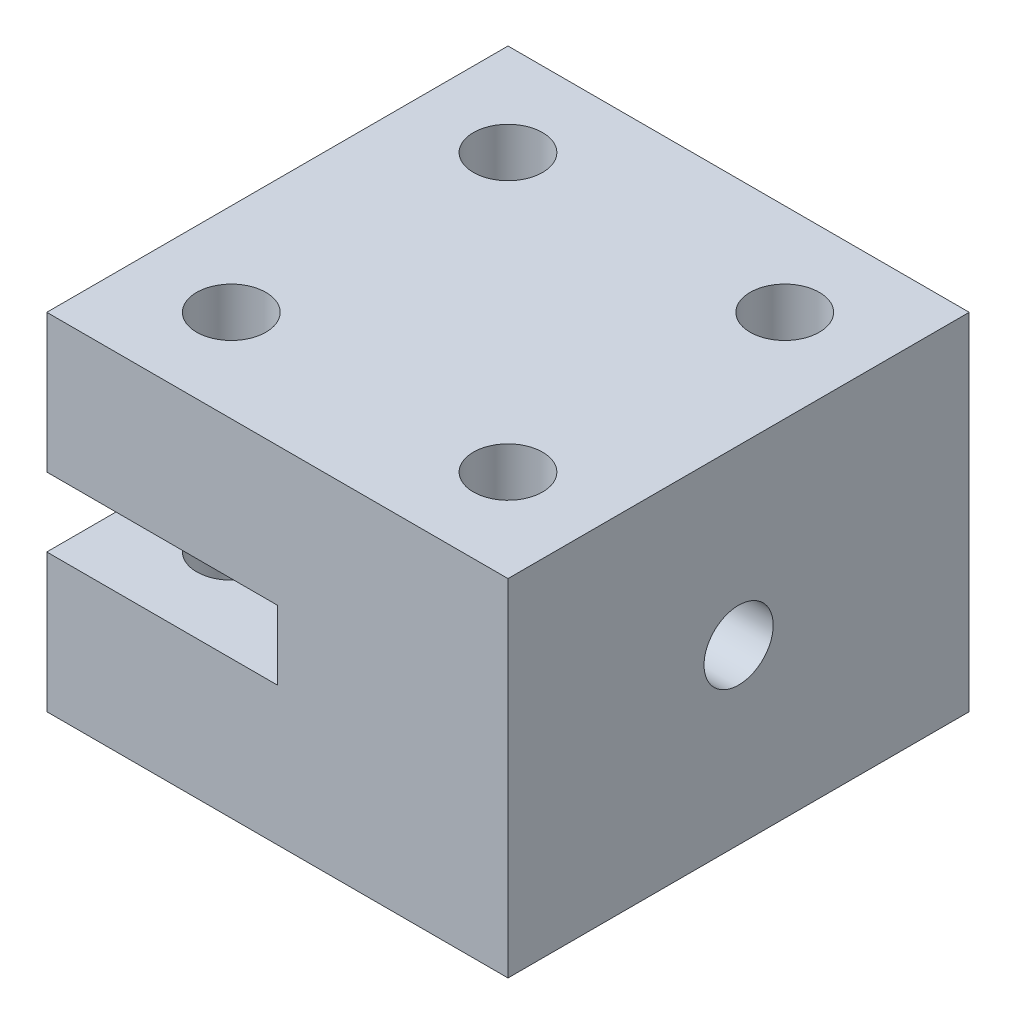
from build123d import *

# Parameters (mm, degrees)
SKETCH1_W               = 20
SKETCH1_H               = 20
BOSS_EXTRUDE1_DEPTH     = 7.5
SKETCH1_3_W             = 20
SKETCH1_3_H             = 20
CUT_EXTRUDE2_DEPTH      = 1.5
SKETCH3_W               = 10
SKETCH3_H               = 20
BOSS_EXTRUDE2_DEPTH     = 1.5
SKETCH4_R               = 1.5
CUT_EXTRUDE3_DEPTH      = 7.5
CUT_EXTRUDE4_DEPTH      = 17.007810594
CUT_EXTRUDE4_DEPTH_BACK = 17.007810594
SKETCH5_R               = 1.5


with BuildPart() as part:
    # Sketch1 → Boss-Extrude1 (new, symmetric)
    with BuildSketch(Plane(origin=(0, 0, 0), x_dir=(1, 0, 0), z_dir=(0, 1, 0))):
        Rectangle(SKETCH1_W, SKETCH1_H)
    extrude(amount=BOSS_EXTRUDE1_DEPTH, both=True)

    # Sketch1<3> → Cut-Extrude2 (cut, symmetric)
    with BuildSketch(Plane(origin=(0, 0, 0), x_dir=(1, 0, 0), z_dir=(0, 1, 0))):
        Rectangle(SKETCH1_3_W, SKETCH1_3_H)
    extrude(amount=CUT_EXTRUDE2_DEPTH, both=True, mode=Mode.SUBTRACT)


with BuildPart() as cut_extrude2_piece_1:
    # of the separate pieces the step leaves, piece 1, a body of its own (cut_extrude2_pieces)
    add(part.part.solids().sort_by_distance((-10, -7.5, -10))[0])



with BuildPart() as cut_extrude2_piece_2:
    # of the separate pieces the step leaves, piece 2, a body of its own (cut_extrude2_pieces)
    add(part.part.solids().sort_by_distance((-10, 1.5, -10))[0])


with BuildPart() as cut_extrude2_piece_1_1:
    add(cut_extrude2_piece_1.part)

    add(cut_extrude2_piece_2.part)  # Boss-Extrude2 merges Cut-Extrude2 piece 2
    # Sketch3 → Boss-Extrude2 (add, symmetric)
    with BuildSketch(Plane(origin=(0, 0, 0), x_dir=(1, 0, 0), z_dir=(0, 1, 0))):
        with Locations((5, 0)):
            Rectangle(SKETCH3_W, SKETCH3_H)
    extrude(amount=BOSS_EXTRUDE2_DEPTH, both=True)

    # Sketch4 → Cut-Extrude3 (cut)
    with BuildSketch(Plane(origin=(10, 0, 0), x_dir=(0, 0, -1), z_dir=(1, 0, 0))):
        Circle(SKETCH4_R)
    extrude(amount=-CUT_EXTRUDE3_DEPTH, mode=Mode.SUBTRACT)

    # Sketch5 → Cut-Extrude4 (cut, two sides: drawn at the far end of the back side and taken through both)
    with BuildSketch(Plane(origin=(0, 0, 0), x_dir=(1, 0, 0), z_dir=(0, 1, 0)).offset(-CUT_EXTRUDE4_DEPTH_BACK)):
        with Locations((-6, 6)):
            Circle(SKETCH5_R)
        with Locations((6, 6)):
            Circle(SKETCH5_R)
        with Locations((6, -6)):
            Circle(SKETCH5_R)
        with Locations((-6, -6)):
            Circle(SKETCH5_R)
    extrude(amount=CUT_EXTRUDE4_DEPTH + CUT_EXTRUDE4_DEPTH_BACK, mode=Mode.SUBTRACT)


solid = cut_extrude2_piece_1_1.part
